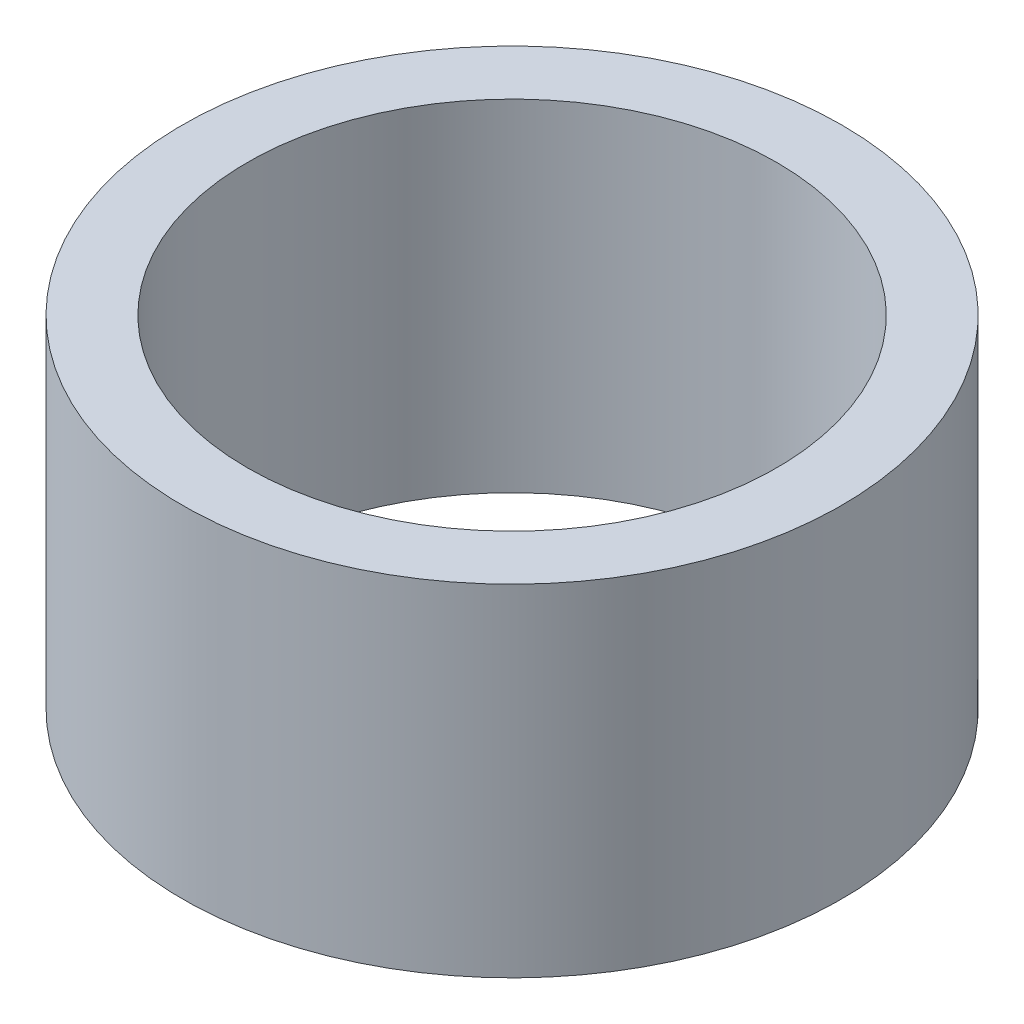
from build123d import *

# Parameters (mm, degrees)
SKETCH1_R           = 10.15
SKETCH1_R_2         = 8.15
BOSS_EXTRUDE1_DEPTH = 10.5


with BuildPart() as part:
    # Sketch1 → Boss-Extrude1 (new body)
    with BuildSketch(Plane(origin=(0, 0, 0), x_dir=(1, 0, 0), z_dir=(0, 1, 0))):
        with Locations(Location((0, 0, 0), (0, 0, 90))):
            Circle(SKETCH1_R)
        with Locations(Location((0, 0, 0), (0, 0, 90))):
            Circle(SKETCH1_R_2, mode=Mode.SUBTRACT)
    extrude(amount=BOSS_EXTRUDE1_DEPTH)


solid = part.part
